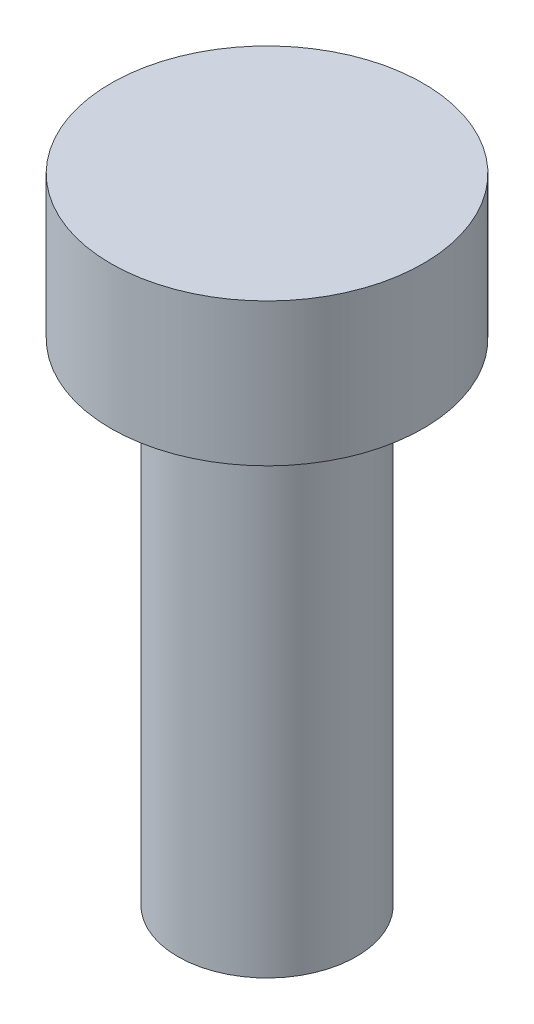
from build123d import *

# Parameters (mm, degrees)
ESQUISSE1_R        = 1.75
BOSS_EXTRU_1_DEPTH = 1.6
ESQUISSE2_R        = 1
BOSS_EXTRU_2_DEPTH = 5.5


with BuildPart() as part:
    # Esquisse1 → Boss.-Extru.1 (new body)
    with BuildSketch(Plane(origin=(0, 0, 0), x_dir=(1, 0, 0), z_dir=(0, 1, 0))):
        with Locations(Location((0, 0, 0), (0, 0, 270))):
            Circle(ESQUISSE1_R)
    extrude(amount=BOSS_EXTRU_1_DEPTH)

    # Esquisse2 → Boss.-Extru.2 (add)
    with BuildSketch(Plane.XZ):
        with Locations(Location((0, 0, 0), (0, 0, 270))):
            Circle(ESQUISSE2_R)
    extrude(amount=BOSS_EXTRU_2_DEPTH)


solid = part.part
